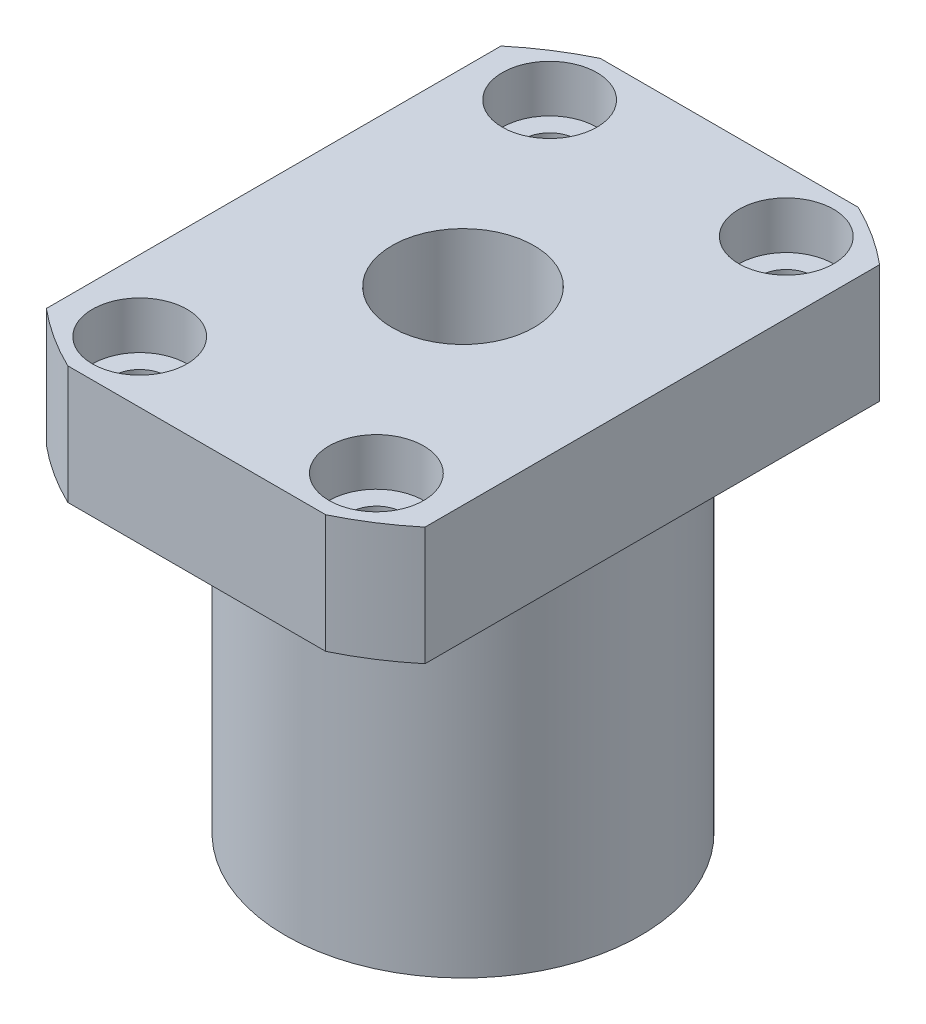
from build123d import *

# Parameters (mm, degrees)
SKETCH_1_R                   = 15
EXTRUDE_1_DEPTH              = 30
SKETCH_2_W                   = 32
SKETCH_2_H                   = 45
EXTRUDE_2_DEPTH              = 10
HOLE_WIZARD_M4_1_D           = 4.5
HOLE_WIZARD_M4_1_CBORE_D     = 8
HOLE_WIZARD_M4_1_CBORE_DEPTH = 4
SKETCH_6_W                   = 78.990137636
SKETCH_6_H                   = 62.836735256
SKETCH_6_R                   = 25
CUT_EXTRUDE_1_DEPTH          = 30
SKETCH_7_R                   = 6
CUT_EXTRUDE_2_DEPTH          = 49.602983448


with BuildPart() as part:
    # 스케치1 → 보스-돌출1 (new body)
    with BuildSketch(Plane(origin=(0, 0, 0), x_dir=(1, 0, 0), z_dir=(0, 1, 0))):
        with Locations(Location((0, 0, 0), (0, 0, 270))):
            Circle(SKETCH_1_R)
    extrude(amount=EXTRUDE_1_DEPTH)

    # 스케치2 → 보스-돌출2 (add)
    with BuildSketch(Plane(origin=(0, 30, 0), x_dir=(1, 0, 0), z_dir=(0, 1, 0))):
        Rectangle(SKETCH_2_W, SKETCH_2_H)
    extrude(amount=EXTRUDE_2_DEPTH)

    # M4 소켓 머리 캡 나사용 카운터보어1 (through all)
    with Locations(Plane(origin=(0, 40, 0), x_dir=(1, 0, 0), z_dir=(0, 1, 0))):
        with Locations((-10, 17.320508076), (10, 17.320508076), (10, -17.320508076), (-10, -17.320508076)):
            CounterBoreHole(HOLE_WIZARD_M4_1_D / 2, HOLE_WIZARD_M4_1_CBORE_D / 2, HOLE_WIZARD_M4_1_CBORE_DEPTH)

    # 스케치6 → 컷-돌출1 (cut)
    with BuildSketch(Plane(origin=(0, 40, 0), x_dir=(1, 0, 0), z_dir=(0, 1, 0))):
        Rectangle(SKETCH_6_W, SKETCH_6_H)
        Circle(SKETCH_6_R, mode=Mode.SUBTRACT)
    extrude(amount=-CUT_EXTRUDE_1_DEPTH, mode=Mode.SUBTRACT)

    # 스케치7 → 컷-돌출2 (cut, through all)
    with BuildSketch(Plane(origin=(0, 40, 0), x_dir=(1, 0, 0), z_dir=(0, 1, 0))):
        with Locations(Location((0, 0, 0), (0, 0, 270))):
            Circle(SKETCH_7_R)
    extrude(amount=-CUT_EXTRUDE_2_DEPTH, mode=Mode.SUBTRACT)


solid = part.part
